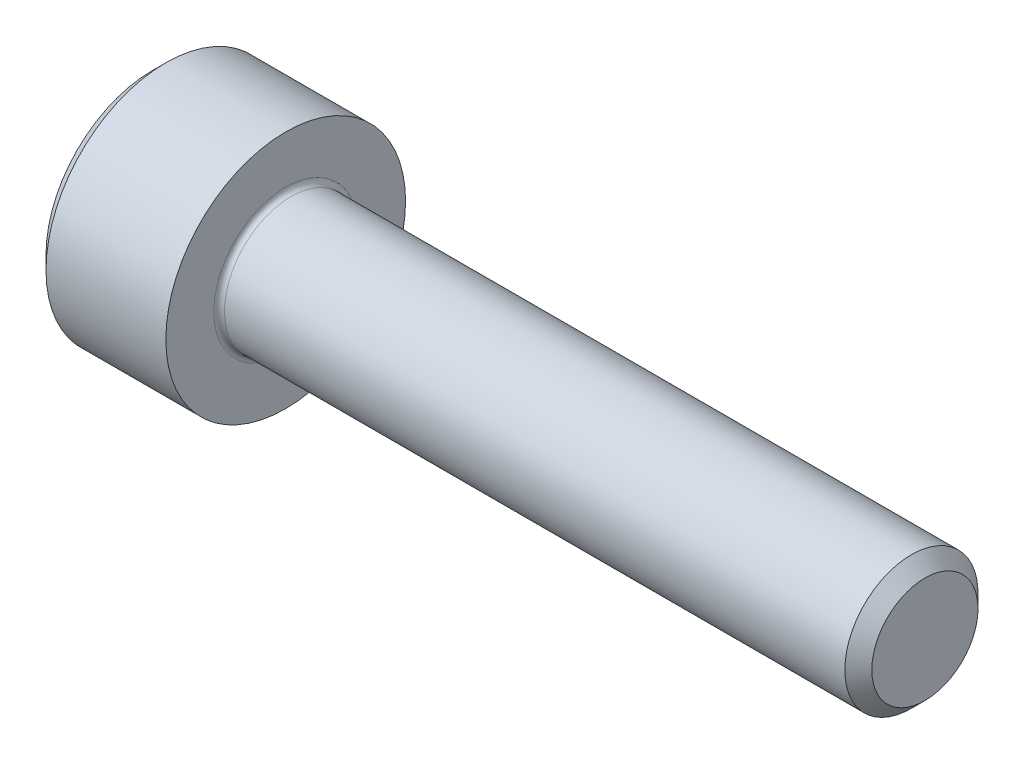
from build123d import *

# Parameters (mm, degrees)
FILLET1_R   = 0.1
HEX_2_DEPTH = 1.1


with BuildPart() as part:
    # BodySke → Base-Revolve (revolve)
    with BuildSketch(Plane.XY, mode=Mode.PRIVATE) as base_revolve_sk:
        Polygon((0, 0), (0, 2), (0.25, 2.25), (2.5, 2.25), (2.5, 1.25), (14.2465, 1.25), (14.5, 0.9965), (14.5, 0), align=None)
    revolve(base_revolve_sk.sketch.rotate(Axis((-31.75, 0, 0), (1, 0, 0)), 90), axis=Axis((-31.75, 0, 0), (1, 0, 0)))

    # Fillet1
    fillet1_edges = [part.edges().sort_by_distance(p)[0] for p in [
        (2.5, 0, -1.25),
    ]]
    fillet(fillet1_edges, radius=FILLET1_R)

    # Sketch2 → Hex-PreBroach (revolve, cut)
    with BuildSketch(Plane.XY, mode=Mode.PRIVATE) as hex_prebroach_sk:
        Polygon((0, 1.0225), (1.1, 1.0225), (1.69034065, 0), (0, 0), align=None)
    revolve(hex_prebroach_sk.sketch.rotate(Axis((0, 0, 0), (1, 0, 0)), 90), axis=Axis((0, 0, 0), (1, 0, 0)), mode=Mode.SUBTRACT)

    # Sketch3 → Hex 2 (cut)
    with BuildSketch(Plane(origin=(0, 0, 0), x_dir=(0, 0.500000000000001, 0.866025403784438), z_dir=(-1, 0, 0))):
        Polygon((0.59034065, 1.0225), (-0.59034065, 1.0225), (-1.1806813, 0), (-0.59034065, -1.0225), (0.59034065, -1.0225), (1.1806813, 0), align=None)
    extrude(amount=-HEX_2_DEPTH, mode=Mode.SUBTRACT)


solid = part.part
